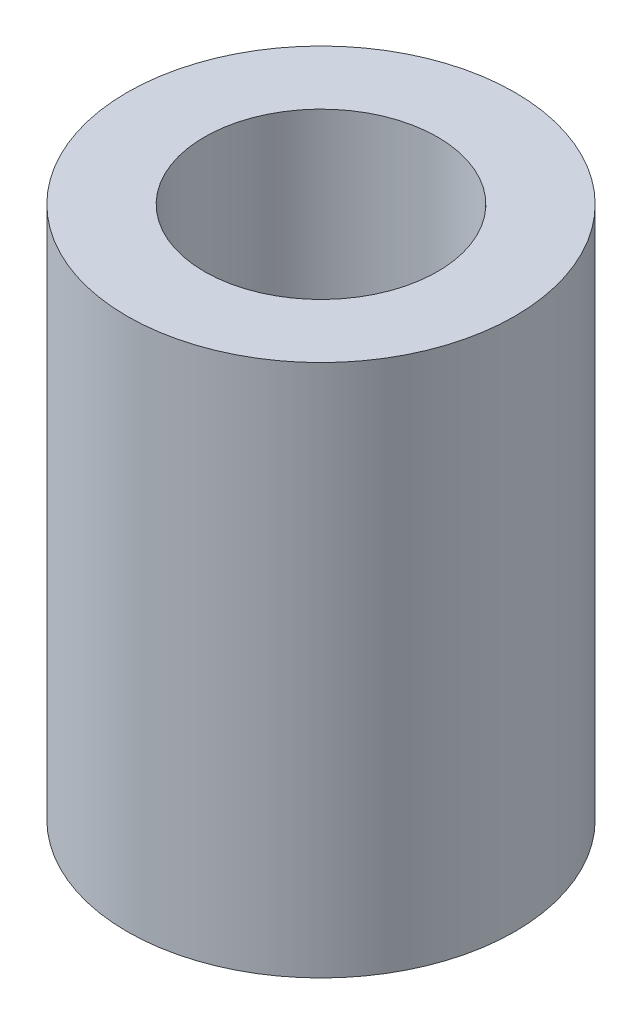
from build123d import *

# Parameters (mm, degrees)
SKETCH1_R           = 2.910000014
SKETCH1_R_2         = 1.75
BOSS_EXTRUDE1_DEPTH = 8


with BuildPart() as part:
    # Sketch1 → Boss-Extrude1 (new body)
    with BuildSketch(Plane(origin=(0, 0, 0), x_dir=(1, 0, 0), z_dir=(0, 1, 0))):
        with Locations(Location((0, 0, 0), (0, 0, 270))):
            Circle(SKETCH1_R)
        with Locations(Location((0, 0, 0), (0, 0, 270))):
            Circle(SKETCH1_R_2, mode=Mode.SUBTRACT)
    extrude(amount=BOSS_EXTRUDE1_DEPTH)


solid = part.part
